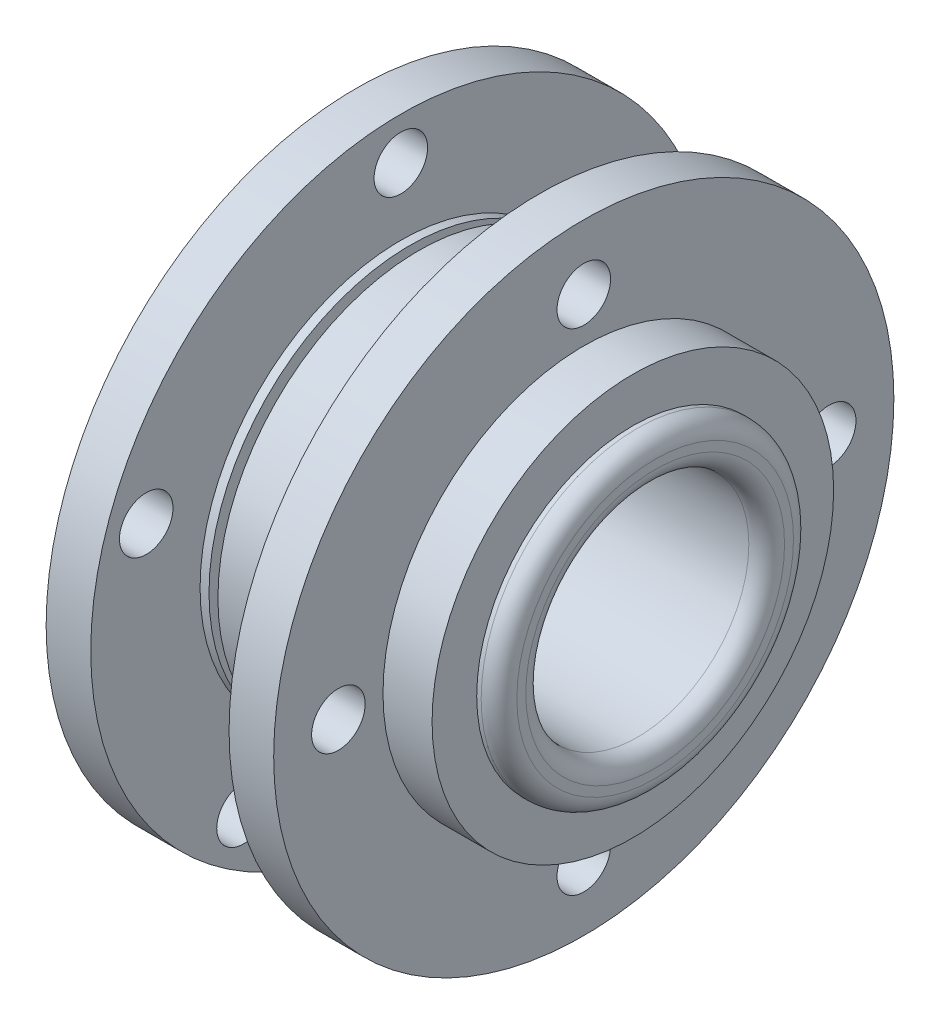
from build123d import *

# Parameters (mm, degrees)
SZKIC4_R                   = 6
WYTNIJ_WYCI_GNI_CIE1_DEPTH = 10
SZKIC5_R                   = 6
WYTNIJ_WYCI_GNI_CIE2_DEPTH = 10
SZKIC6_R                   = 35
WYTNIJ_WYCI_GNI_CIE3_DEPTH = 15
WYTNIJ_WYCI_GNI_CIE4_START = -5
SZKIC7_R                   = 45
SZKIC7_R_2                 = 35
WYTNIJ_WYCI_GNI_CIE4_DEPTH = 5
SZKIC8_R                   = 25
WYTNIJ_WYCI_GNI_CIE5_DEPTH = 70
ZAOKR_GLENIE1_R            = 4
SZKIC9_W                   = 2
SZKIC9_H                   = 3


with BuildPart() as part:
    # Szkic2 → Obrót1 (revolve)
    with BuildSketch(Plane.XY, mode=Mode.PRIVATE) as obr_t1_sk:
        Polygon((82, 0), (82, 45), (66, 45), (66, 69.5), (56, 69.5), (56, 45), (25, 45), (25, 69.5), (15, 69.5), (15, 39.5), (0, 39.5), (0, 0), align=None)
    revolve(obr_t1_sk.sketch.rotate(Axis((0, 0, 0), (1, 0, 0)), 90), axis=Axis((0, 0, 0), (1, 0, 0)))

    # Szkic4 → Wytnij-wyciągnięcie1 (cut)
    with BuildSketch(Plane(origin=(66, 0, 0), x_dir=(0, 0, -1), z_dir=(1, 0, 0))):
        with Locations((0, 55)):
            Circle(SZKIC4_R)
        with Locations((55, 0)):
            Circle(SZKIC4_R)
        with Locations((0, -55)):
            Circle(SZKIC4_R)
        with Locations((-55, 0)):
            Circle(SZKIC4_R)
    extrude(amount=-WYTNIJ_WYCI_GNI_CIE1_DEPTH, mode=Mode.SUBTRACT)

    # Szkic5 → Wytnij-wyciągnięcie2 (cut)
    with BuildSketch(Plane.ZY.offset(-15)):
        with Locations((0, 60)):
            Circle(SZKIC5_R)
        with Locations((57.063390978, 18.541019662)):
            Circle(SZKIC5_R)
        with Locations((35.267115138, -48.541019662)):
            Circle(SZKIC5_R)
        with Locations((-35.267115138, -48.541019662)):
            Circle(SZKIC5_R)
        with Locations((-57.063390978, 18.541019662)):
            Circle(SZKIC5_R)
    extrude(amount=-WYTNIJ_WYCI_GNI_CIE2_DEPTH, mode=Mode.SUBTRACT)

    # Szkic6 → Wytnij-wyciągnięcie3 (cut)
    with BuildSketch(Plane.ZY):
        Circle(SZKIC6_R)
    extrude(amount=-WYTNIJ_WYCI_GNI_CIE3_DEPTH, mode=Mode.SUBTRACT)

    # Szkic7 → Wytnij-wyciągnięcie4 (cut)
    with BuildSketch(Plane(origin=(82, 0, 0), x_dir=(0, 0, -1), z_dir=(1, 0, 0)).offset(WYTNIJ_WYCI_GNI_CIE4_START)):
        with Locations(Location((0, 0, 0), (0, 0, 180))):
            Circle(SZKIC7_R)
        with Locations(Location((0, 0, 0), (0, 0, 180))):
            Circle(SZKIC7_R_2, mode=Mode.SUBTRACT)
    extrude(amount=WYTNIJ_WYCI_GNI_CIE4_DEPTH, mode=Mode.SUBTRACT)

    # Szkic8 → Wytnij-wyciągnięcie5 (cut)
    with BuildSketch(Plane(origin=(82, 0, 0), x_dir=(0, 0, -1), z_dir=(1, 0, 0))):
        Circle(SZKIC8_R)
    extrude(amount=-WYTNIJ_WYCI_GNI_CIE5_DEPTH, mode=Mode.SUBTRACT)

    # Zaokrąglenie1
    zaokr_glenie1_edges = [part.edges().sort_by_distance(p)[0] for p in [
        (82, 0, -35),
        (82, 0, 25),
    ]]
    fillet(zaokr_glenie1_edges, radius=ZAOKR_GLENIE1_R)

    # Szkic9 → Wycięcie-obrót1 (revolve, cut)
    with BuildSketch(Plane.XY, mode=Mode.PRIVATE) as wyci_cie_obr_t1_sk:
        with Locations((28, 43.5)):
            Rectangle(SZKIC9_W, SZKIC9_H)
    revolve(wyci_cie_obr_t1_sk.sketch.rotate(Axis((-4.1, 0, 0), (1, 0, 0)), 90), axis=Axis((-4.1, 0, 0), (1, 0, 0)), mode=Mode.SUBTRACT)


solid = part.part
